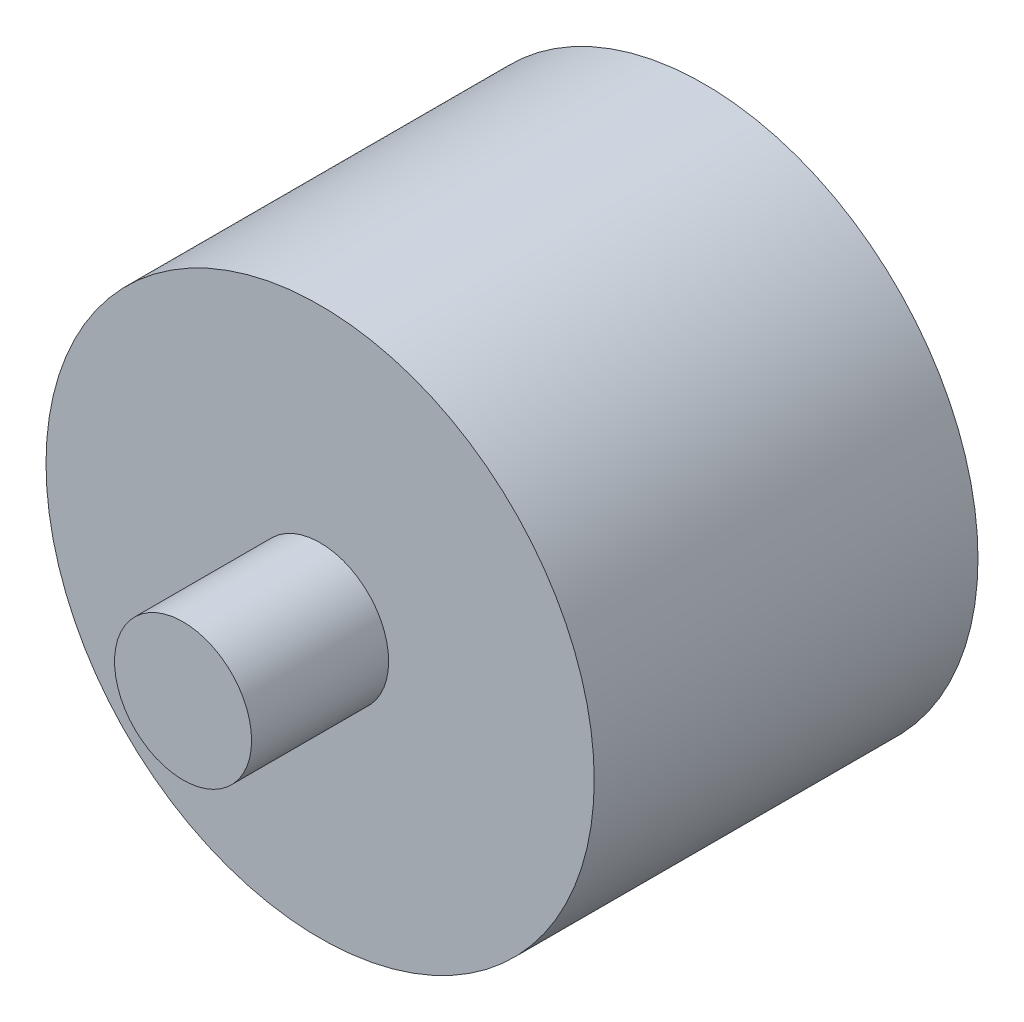
from build123d import *

# Parameters (mm, degrees)
SKETCH1_R           = 2.5
BOSS_EXTRUDE1_DEPTH = 24
BOSS_EXTRUDE2_START = -5
SKETCH2_R           = 10
BOSS_EXTRUDE2_DEPTH = 14


with BuildPart() as part:
    # Sketch1 → Boss-Extrude1 (new body)
    with BuildSketch(Plane.XY):
        Circle(SKETCH1_R)
    extrude(amount=BOSS_EXTRUDE1_DEPTH)

    # Sketch2 → Boss-Extrude2 (add)
    with BuildSketch(Plane.XY.offset(24).offset(BOSS_EXTRUDE2_START)):
        Circle(SKETCH2_R)
    extrude(amount=-BOSS_EXTRUDE2_DEPTH)


solid = part.part
